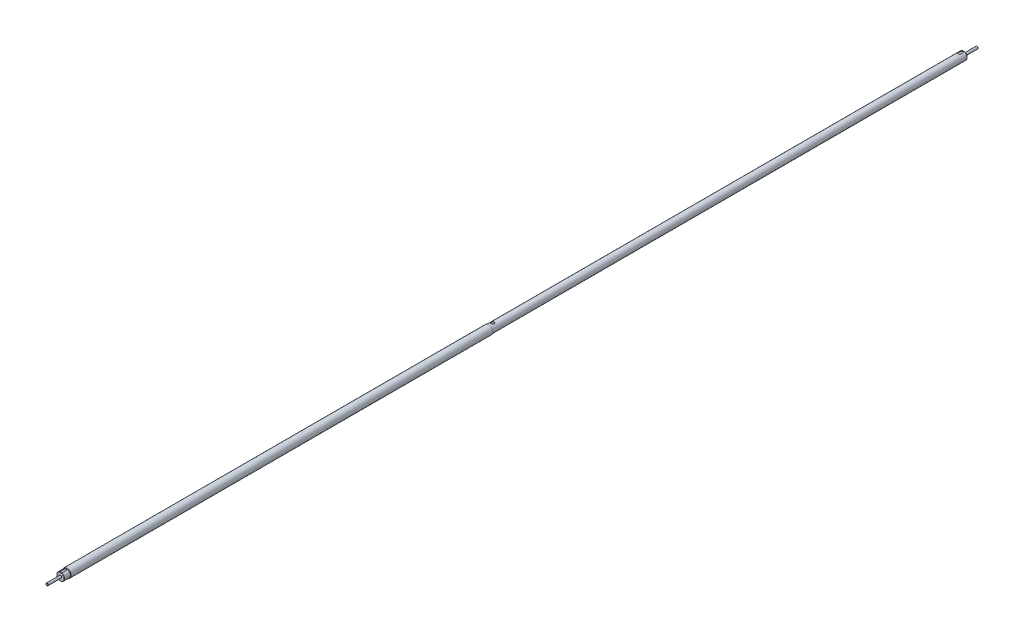
from build123d import *

# Parameters (mm, degrees)
CUT_EXTRUDE_1_DEPTH = 1.2
CUT_EXTRUDE_2_DEPTH = 1.2
SKETCH_4_R          = 4
CUT_EXTRUDE_3_DEPTH = 10
CHAMFER_1_SIZE      = 0.5
FILLET_1_R          = 0.2
FILLET_2_R          = 0.2
CHAMFER_2_SIZE      = 0.5
CHAMFER_3_SIZE      = 0.5
FILLET_3_R          = 0.2


with BuildPart() as part:
    # Эскиз1 → Повернуть1 (revolve)
    with BuildSketch(Plane(origin=(0, 0, 0), x_dir=(0, 0, -1), z_dir=(1, 0, 0)), mode=Mode.PRIVATE) as revolve_1_sk:
        Polygon((0, 0), (0, 3), (35, 3), (35, 10), (51, 10), (51, 11), (1145, 11), (1145, 10), (1185, 10), (2375, 10), (2375, 3), (2410, 3), (2410, 0), align=None)
    revolve(revolve_1_sk.sketch.rotate(Axis((0, 0, 0), (0, 0, -1)), 90), axis=Axis((0, 0, 0), (0, 0, -1)))

    # Эскиз2 → Вырез-Вытянуть1 (cut)
    with BuildSketch(Plane(origin=(0, 10, 0), x_dir=(1, 0, 0), z_dir=(0, 1, 0))):
        with BuildLine():
            Line((3, 47), (3, 39))
            ThreePointArc((3, 39), (0, 36), (-3, 39))
            Line((-3, 39), (-3, 47))
            ThreePointArc((-3, 47), (0, 50), (3, 47))
        make_face()
    extrude(amount=-CUT_EXTRUDE_1_DEPTH, mode=Mode.SUBTRACT)

    # Эскиз3 → Вырез-Вытянуть2 (cut)
    with BuildSketch(Plane(origin=(0, 10, 0), x_dir=(1, 0, 0), z_dir=(0, 1, 0))):
        with BuildLine():
            Line((3, 2371), (3, 2363))
            ThreePointArc((3, 2363), (0, 2360), (-3, 2363))
            Line((-3, 2363), (-3, 2371))
            ThreePointArc((-3, 2371), (0, 2374), (3, 2371))
        make_face()
    extrude(amount=-CUT_EXTRUDE_2_DEPTH, mode=Mode.SUBTRACT)

    # Эскиз4 → Вырез-Вытянуть3 (cut)
    with BuildSketch(Plane(origin=(0, 10, 0), x_dir=(1, 0, 0), z_dir=(0, 1, 0))):
        with Locations(Location((0, 1155, 0), (0, 0, 270))):
            Circle(SKETCH_4_R)
    extrude(amount=-CUT_EXTRUDE_3_DEPTH, mode=Mode.SUBTRACT)

    # Фаска1
    chamfer_1_edges = [part.edges().sort_by_distance(p)[0] for p in [
        (-3, 0, 0),
        (-10, 0, -35),
        (-11, 0, -51),
    ]]
    chamfer(chamfer_1_edges, length=CHAMFER_1_SIZE)

    # Скругление1
    fillet_1_edges = [part.edges().sort_by_distance(p)[0] for p in [
        (-10, 0, -51),
    ]]
    fillet(fillet_1_edges, radius=FILLET_1_R)

    # Скругление2
    fillet_2_edges = [part.edges().sort_by_distance(p)[0] for p in [
        (-10, 0, -1145),
    ]]
    fillet(fillet_2_edges, radius=FILLET_2_R)

    # Фаска2
    chamfer_2_edges = [part.edges().sort_by_distance(p)[0] for p in [
        (-11, 0, -1145),
    ]]
    chamfer(chamfer_2_edges, length=CHAMFER_2_SIZE)

    # Фаска3
    chamfer_3_edges = [part.edges().sort_by_distance(p)[0] for p in [
        (-10, 0, -2375),
        (-3, 0, -2410),
    ]]
    chamfer(chamfer_3_edges, length=CHAMFER_3_SIZE)

    # Скругление3
    fillet_3_edges = [part.edges().sort_by_distance(p)[0] for p in [
        (-3, 0, -2375),
    ]]
    fillet(fillet_3_edges, radius=FILLET_3_R)


solid = part.part
